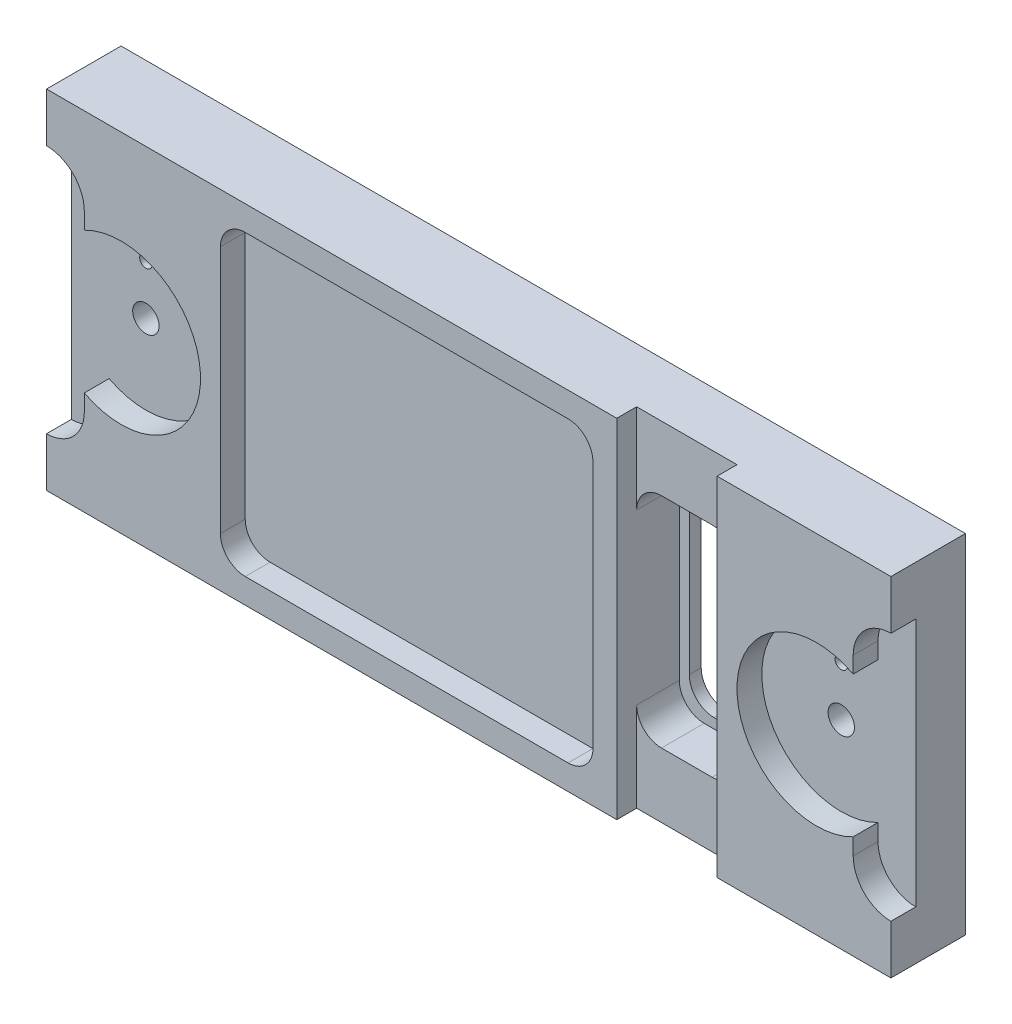
from build123d import *

# Parameters (mm, degrees)
SKETCH1_W           = 215.9
SKETCH1_H           = 19.05
BOSS_EXTRUDE1_DEPTH = 88.9
SKETCH2_W           = 25.654
SKETCH2_H           = 88.9
CUT_EXTRUDE1_DEPTH  = 5.08
CUT_EXTRUDE2_DEPTH  = 6.35
CUT_EXTRUDE3_DEPTH  = 141.54029102
CUT_EXTRUDE4_DEPTH  = 10.922
CUT_EXTRUDE5_DEPTH  = 6.35
SKETCH9_R           = 3.3734375
SKETCH9_R_2         = 1.5875
CUT_EXTRUDE6_DEPTH  = 142.135803395
SKETCH10_R          = 4.7625
CUT_EXTRUDE7_DEPTH  = 6.35


with BuildPart() as part:
    # Sketch1 → Boss-Extrude1 (new body)
    with BuildSketch(Plane(origin=(0, 0, 0), x_dir=(1, 0, 0), z_dir=(0, 1, 0))):
        Rectangle(SKETCH1_W, SKETCH1_H)
    extrude(amount=BOSS_EXTRUDE1_DEPTH)

    # Sketch2 → Cut-Extrude1 (cut)
    with BuildSketch(Plane.XY.offset(9.525)):
        with Locations((50.673, 44.45)):
            Rectangle(SKETCH2_W, SKETCH2_H)
    extrude(amount=-CUT_EXTRUDE1_DEPTH, mode=Mode.SUBTRACT)

    # Sketch3 → Cut-Extrude2 (cut)
    with BuildSketch(Plane.XY.offset(9.525)):
        with BuildLine():
            Line((-57.15, 82.55), (25.4, 82.55))
            ThreePointArc((25.4, 82.55), (29.890128061, 80.690128061), (31.75, 76.2))
            Line((31.75, 76.2), (31.75, 12.7))
            ThreePointArc((31.75, 12.7), (29.890128061, 8.209871939), (25.4, 6.35))
            Line((25.4, 6.35), (-57.15, 6.35))
            ThreePointArc((-57.15, 6.35), (-61.640128061, 8.209871939), (-63.5, 12.7))
            Line((-63.5, 12.7), (-63.5, 76.2))
            ThreePointArc((-63.5, 76.2), (-61.640128061, 80.690128061), (-57.15, 82.55))
        make_face()
    extrude(amount=-CUT_EXTRUDE2_DEPTH, mode=Mode.SUBTRACT)

    # Sketch6 → Cut-Extrude3 (cut, through all)
    with BuildSketch(Plane.XY.offset(4.445)):
        with BuildLine():
            Line((46.736, 69.85), (54.61, 69.85))
            ThreePointArc((54.61, 69.85), (59.100128061, 67.990128061), (60.96, 63.5))
            Line((60.96, 63.5), (60.96, 25.4))
            ThreePointArc((60.96, 25.4), (59.100128061, 20.909871939), (54.61, 19.05))
            Line((54.61, 19.05), (46.736, 19.05))
            ThreePointArc((46.736, 19.05), (42.245871939, 20.909871939), (40.386, 25.4))
            Line((40.386, 25.4), (40.386, 63.5))
            ThreePointArc((40.386, 63.5), (42.245871939, 67.990128061), (46.736, 69.85))
        make_face()
    extrude(amount=-CUT_EXTRUDE3_DEPTH, mode=Mode.SUBTRACT)

    # Sketch5 → Cut-Extrude4 (cut)
    with BuildSketch(Plane.XY.offset(4.445)):
        with BuildLine():
            Line((44.196, 72.39), (57.15, 72.39))
            ThreePointArc((57.15, 72.39), (61.640128061, 70.530128061), (63.5, 66.04))
            Line((63.5, 66.04), (63.5, 22.86))
            ThreePointArc((63.5, 22.86), (61.640128061, 18.369871939), (57.15, 16.51))
            Line((57.15, 16.51), (44.196, 16.51))
            ThreePointArc((44.196, 16.51), (39.705871939, 18.369871939), (37.846, 22.86))
            Line((37.846, 22.86), (37.846, 66.04))
            ThreePointArc((37.846, 66.04), (39.705871939, 70.530128061), (44.196, 72.39))
        make_face()
    extrude(amount=-CUT_EXTRUDE4_DEPTH, mode=Mode.SUBTRACT)

    # Sketch8 → Cut-Extrude5 (cut)
    with BuildSketch(Plane.XY.offset(9.525)):
        with BuildLine():
            ThreePointArc((-98.298, 26.433896204), (-68.58, 44.45), (-98.298, 62.466103796))
            Line((-98.298, 62.466103796), (-98.298, 26.433896204))
        make_face()
        with BuildLine():
            Line((-98.298, 62.466103796), (-98.298, 66.675))
            ThreePointArc((-98.298, 66.675), (-101.125005348, 73.499994652), (-107.95, 76.327))
            Line((-107.95, 76.327), (-107.95, 12.573))
            ThreePointArc((-107.95, 12.573), (-101.125005348, 15.400005348), (-98.298, 22.225))
            Line((-98.298, 22.225), (-98.298, 26.433896204))
            Line((-98.298, 26.433896204), (-98.298, 62.466103796))
        make_face()
    cut_extrude5 = extrude(amount=-CUT_EXTRUDE5_DEPTH, mode=Mode.SUBTRACT)

    # Sketch9 → Cut-Extrude6 (cut, through all)
    with BuildSketch(Plane.XY.offset(9.525)):
        with Locations((-88.9, 44.45)):
            Circle(SKETCH9_R)
        with Locations((-88.9, 57.15)):
            Circle(SKETCH9_R_2)
    cut_extrude6 = extrude(amount=-CUT_EXTRUDE6_DEPTH, mode=Mode.SUBTRACT)

    # Sketch10 → Cut-Extrude7 (cut)
    with BuildSketch(Plane(origin=(0, 0, -9.525), x_dir=(-1, 0, 0), z_dir=(0, 0, -1))):
        with Locations((88.9, 44.45)):
            Circle(SKETCH10_R)
    cut_extrude7 = extrude(amount=-CUT_EXTRUDE7_DEPTH, mode=Mode.SUBTRACT)

    # Mirror1: Cut-Extrude5, Cut-Extrude6, Cut-Extrude7 across plane
    add(cut_extrude5.mirror(Plane(origin=(0, 0, 0), x_dir=(0, 0, 1), z_dir=(1, 0, 0))), mode=Mode.SUBTRACT)
    add(cut_extrude6.mirror(Plane(origin=(0, 0, 0), x_dir=(0, 0, 1), z_dir=(1, 0, 0))), mode=Mode.SUBTRACT)
    add(cut_extrude7.mirror(Plane(origin=(0, 0, 0), x_dir=(0, 0, 1), z_dir=(1, 0, 0))), mode=Mode.SUBTRACT)


solid = part.part
